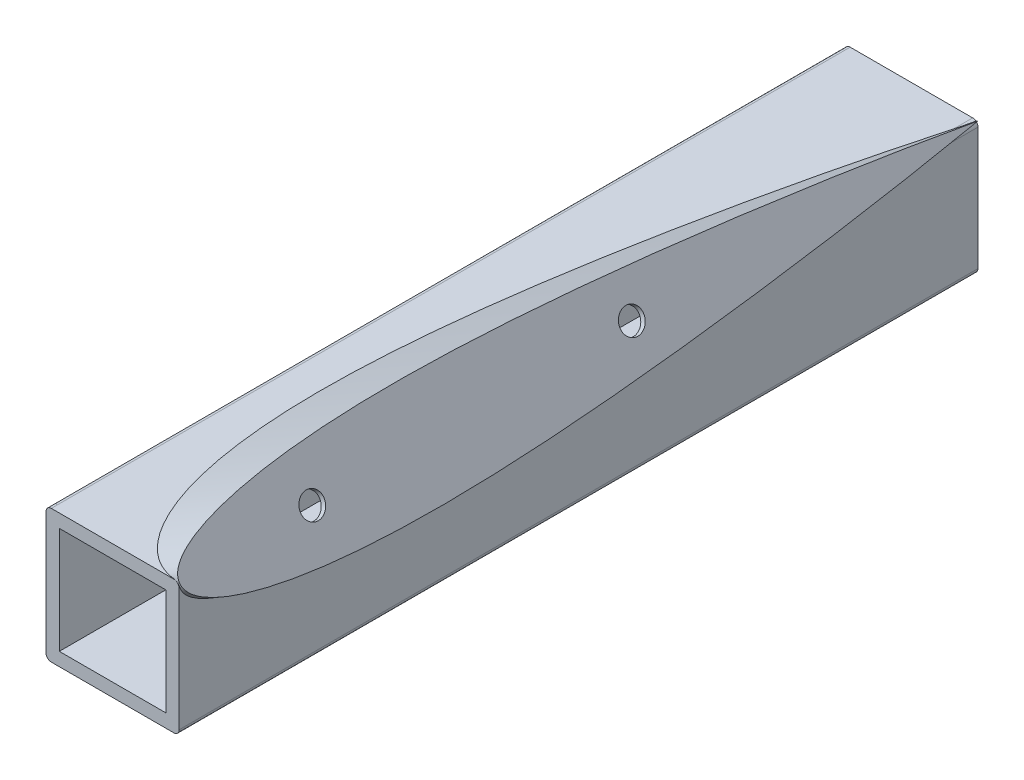
from build123d import *

# Parameters (mm, degrees)
SKETCH1_W                                           = 25
SKETCH1_H                                           = 25
BOSS_EXTRUDE1_DEPTH                                 = 150
FILLET1_R                                           = 1
BOSS_EXTRUDE2_DEPTH                                 = 20
SKETCH6_W                                           = 20
SKETCH6_H                                           = 20
CUT_EXTRUDE1_DEPTH                                  = 150
SKETCH9_W                                           = 10
SKETCH9_H                                           = 10
CUT_EXTRUDE3_DEPTH                                  = 28.339201
CSK_FOR_M4_COUNTERSUNK_FLAT_HEAD_SCREW1_D           = 4.5
CSK_FOR_M4_COUNTERSUNK_FLAT_HEAD_SCREW1_CSINK_D     = 9.4
CSK_FOR_M4_COUNTERSUNK_FLAT_HEAD_SCREW1_CSINK_ANGLE = 90
CSK_FOR_M4_COUNTERSUNK_FLAT_HEAD_SCREW2_D           = 4.5
CSK_FOR_M4_COUNTERSUNK_FLAT_HEAD_SCREW2_CSINK_D     = 9.4
CSK_FOR_M4_COUNTERSUNK_FLAT_HEAD_SCREW2_CSINK_ANGLE = 90


with BuildPart() as part:
    # Sketch1 → Boss-Extrude1 (new body)
    with BuildSketch(Plane.XY):
        Rectangle(SKETCH1_W, SKETCH1_H)
    extrude(amount=BOSS_EXTRUDE1_DEPTH)

    # Fillet1
    fillet1_edges = [part.edges().sort_by_distance(p)[0] for p in [
        (-12.5, 12.5, 75),
        (-12.5, -12.5, 75),
        (12.5, -12.5, 75),
        (12.5, 12.5, 75),
    ]]
    fillet(fillet1_edges, radius=FILLET1_R)

    # Sketch5 → Boss-Extrude2 (add)
    with BuildSketch(Plane(origin=(14.787658774, 8.537658774, 0), x_dir=(0, 0, -1), z_dir=(-0.8660254037844398, -0.499999999999998, 0))):
        with BuildLine():
            add(Edge.make_bspline(
                [(-150, -4.575317547), (-149.982262321, -4.359685757), (-149.945875273, -3.917339016), (-149.656785508, -3.276454979), (-149.206481665, -2.659864462), (-148.581406261, -2.064905926), (-147.789559274, -1.489476787), (-146.830159663, -0.933027277), (-145.705237538, -0.396188443), (-144.416586431, 0.119821863), (-142.966827408, 0.613466196), (-141.359035554, 1.083088501), (-138.919133497, 1.697574803), (-135.497553137, 2.380136521), (-130.966734827, 3.052462556), (-125.915261757, 3.594167558), (-120.38969962, 3.998033022), (-113.346553824, 4.308887266), (-104.731447134, 4.419168334), (-94.550753071, 4.248663012), (-82.752820162, 3.771255721), (-69.615872509, 2.949558348), (-55.524910334, 1.806067244), (-41.215806763, 0.440295145), (-26.872092978, -1.11402043), (-13.42085951, -2.747121767), (-4.579151205, -3.930515777), (-0.494806727, -4.505266318), (-0.029189696, -4.571185077), (0, -4.575317547)],
                knots=[0, 0, 0, 0, 0.004217542, 0.008651859, 0.013562306, 0.019137014, 0.025499556, 0.032726168, 0.040861643, 0.049929832, 0.059940125, 0.070891981, 0.082777029, 0.109285667, 0.139301078, 0.172602407, 0.208924358, 0.247964735, 0.310881146, 0.377906083, 0.447678538, 0.542484027, 0.636086648, 0.724985379, 0.824439816, 0.919092539, 0.990775422, 0.999421708, 1, 1, 1, 1], degree=3))
            add(Edge.make_bspline(
                [(-150, -4.575317547), (-149.982262321, -4.790949337), (-149.945875273, -5.233296078), (-149.656785508, -5.874180116), (-149.206481665, -6.490770633), (-148.581406261, -7.085729168), (-147.789559274, -7.661158307), (-146.830159663, -8.217607817), (-145.705237538, -8.754446651), (-144.416586431, -9.270456957), (-142.966827408, -9.764101291), (-141.359035554, -10.233723596), (-138.919133497, -10.848209898), (-135.497553137, -11.530771616), (-130.966734827, -12.203097651), (-125.915261757, -12.744802652), (-120.38969962, -13.148668116), (-113.346553824, -13.459522361), (-104.731447134, -13.569803428), (-94.550753071, -13.399298107), (-82.752820162, -12.921890815), (-69.615872509, -12.100193442), (-55.524910334, -10.956702339), (-41.215806763, -9.590930239), (-26.872092978, -8.036614665), (-13.42085951, -6.403513328), (-4.579151205, -5.220119317), (-0.494806727, -4.645368776), (-0.029189696, -4.579450018), (0, -4.575317547)],
                knots=[0, 0, 0, 0, 0.004217542, 0.008651859, 0.013562306, 0.019137014, 0.025499556, 0.032726168, 0.040861643, 0.049929832, 0.059940125, 0.070891981, 0.082777029, 0.109285667, 0.139301078, 0.172602407, 0.208924358, 0.247964735, 0.310881146, 0.377906083, 0.447678538, 0.542484027, 0.636086648, 0.724985379, 0.824439816, 0.919092539, 0.990775422, 0.999421708, 1, 1, 1, 1], degree=3))
        make_face()
    extrude(amount=BOSS_EXTRUDE2_DEPTH)

    # Sketch6 → Cut-Extrude1 (cut)
    with BuildSketch(Plane.XY):
        Rectangle(SKETCH6_W, SKETCH6_H)
    extrude(amount=CUT_EXTRUDE1_DEPTH, mode=Mode.SUBTRACT)

    # Sketch9 → Cut-Extrude3 (cut)
    with BuildSketch(Plane(origin=(11.830127019, 6.830127019, 0), x_dir=(0, 0, 1), z_dir=(-0.8660254037844397, -0.499999999999998, 0))):
        with Locations((65, 4.575317547)):
            Rectangle(SKETCH9_W, SKETCH9_H)
        with Locations((125, 4.575317547)):
            Rectangle(SKETCH9_W, SKETCH9_H)
    extrude(amount=CUT_EXTRUDE3_DEPTH, mode=Mode.SUBTRACT)

    # CSK for M4 Countersunk Flat Head Screw1 (through all)
    with Locations(Plane(origin=(11.830127019, 6.830127019, 0), x_dir=(0, 0, 1), z_dir=(-0.8660254037844397, -0.4999999999999981, 0))):
        with Locations((125, 4.575317547)):
            CounterSinkHole(CSK_FOR_M4_COUNTERSUNK_FLAT_HEAD_SCREW1_D / 2, CSK_FOR_M4_COUNTERSUNK_FLAT_HEAD_SCREW1_CSINK_D / 2, counter_sink_angle=CSK_FOR_M4_COUNTERSUNK_FLAT_HEAD_SCREW1_CSINK_ANGLE)

    # CSK for M4 Countersunk Flat Head Screw2 (through all)
    with Locations(Plane(origin=(11.830127019, 6.830127019, 0), x_dir=(0, 0, 1), z_dir=(-0.8660254037844397, -0.4999999999999981, 0))):
        with Locations((64.9999732, 4.575557345)):
            CounterSinkHole(CSK_FOR_M4_COUNTERSUNK_FLAT_HEAD_SCREW2_D / 2, CSK_FOR_M4_COUNTERSUNK_FLAT_HEAD_SCREW2_CSINK_D / 2, counter_sink_angle=CSK_FOR_M4_COUNTERSUNK_FLAT_HEAD_SCREW2_CSINK_ANGLE)


solid = part.part
